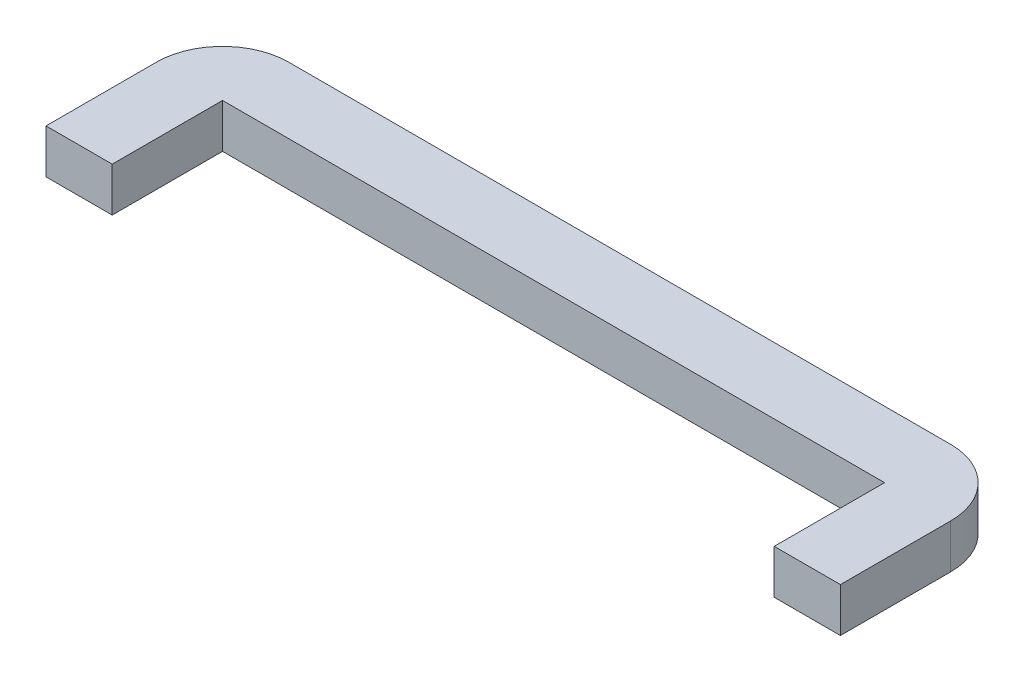
from build123d import *

# Parameters (mm, degrees)
SKETCH1_W           = 36
SKETCH1_H           = 3
SKETCH1_W_2         = 3
SKETCH1_H_2         = 5
BOSS_EXTRUDE1_DEPTH = 1
FILLET1_R           = 3


with BuildPart() as part:
    # Sketch1 → Boss-Extrude1 (new, symmetric)
    with BuildSketch(Plane(origin=(0, 0, 0), x_dir=(1, 0, 0), z_dir=(0, 1, 0))):
        Rectangle(SKETCH1_W, SKETCH1_H)
        with Locations((-16.5, -4)):
            Rectangle(SKETCH1_W_2, SKETCH1_H_2)
        with Locations((16.5, -4)):
            Rectangle(SKETCH1_W_2, SKETCH1_H_2)
    extrude(amount=BOSS_EXTRUDE1_DEPTH, both=True)

    # Fillet1
    fillet1_edges = [part.edges().sort_by_distance(p)[0] for p in [
        (-18, 0, -1.5),
        (18, 0, -1.5),
    ]]
    fillet(fillet1_edges, radius=FILLET1_R)


solid = part.part
